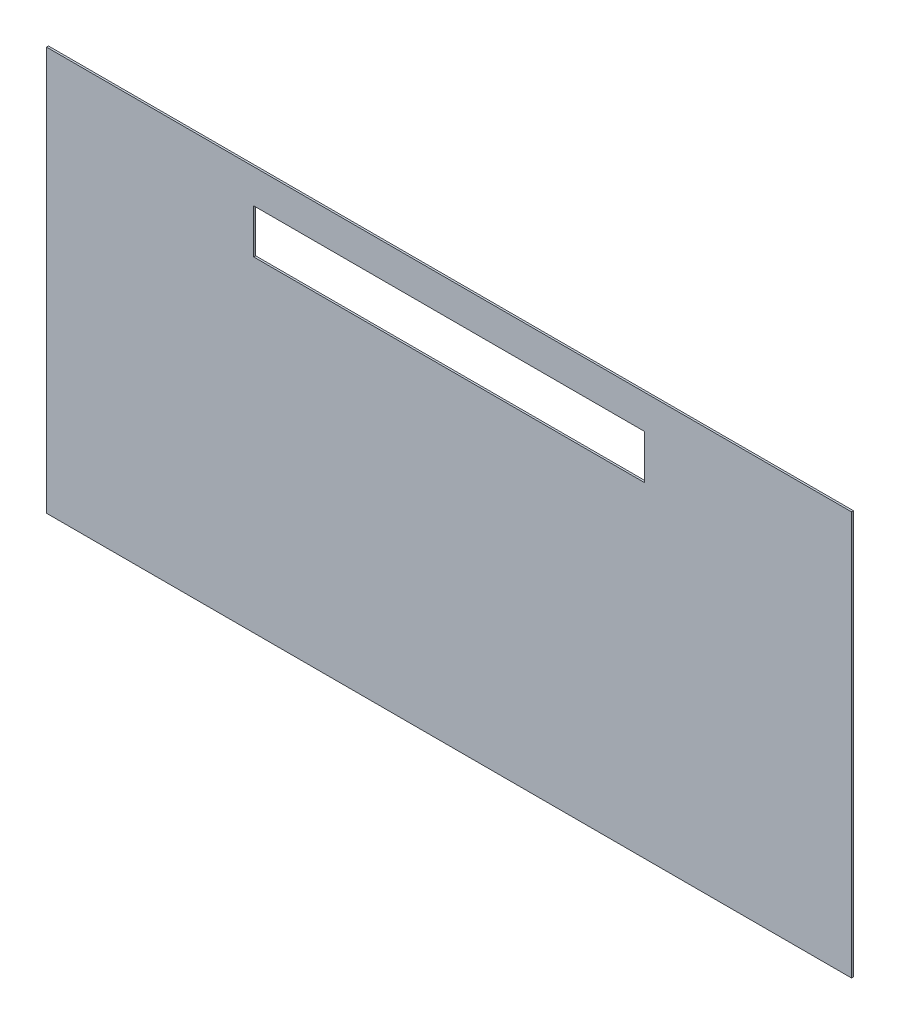
from build123d import *

# Parameters (mm, degrees)
CEK_1L_ON_DIS_SAC_1_5_1_START = 38.5
SKETCH1_W                     = 618
SKETCH1_H                     = 310
CEK_1L_ON_DIS_SAC_1_5_1_DEPTH = 1.5
CEK_1L_ON_DIS_SAC_1_5_2_START = 27
SKETCH2_W                     = 300
SKETCH2_H                     = 34
CEK_1L_ON_DIS_SAC_1_5_2_DEPTH = 14


with BuildPart() as part:
    # Sketch1 → CEK_1L_on_dis_sac_1.5_1 (new body)
    with BuildSketch(Plane.XY.offset(CEK_1L_ON_DIS_SAC_1_5_1_START)):
        with Locations((309, 155)):
            Rectangle(SKETCH1_W, SKETCH1_H)
    extrude(amount=CEK_1L_ON_DIS_SAC_1_5_1_DEPTH)

    # Sketch2 → CEK_1L_on_dis_sac_1.5_2 (cut)
    with BuildSketch(Plane.XY.offset(CEK_1L_ON_DIS_SAC_1_5_2_START)):
        with Locations((309, 267)):
            Rectangle(SKETCH2_W, SKETCH2_H)
    extrude(amount=CEK_1L_ON_DIS_SAC_1_5_2_DEPTH, mode=Mode.SUBTRACT)


solid = part.part
